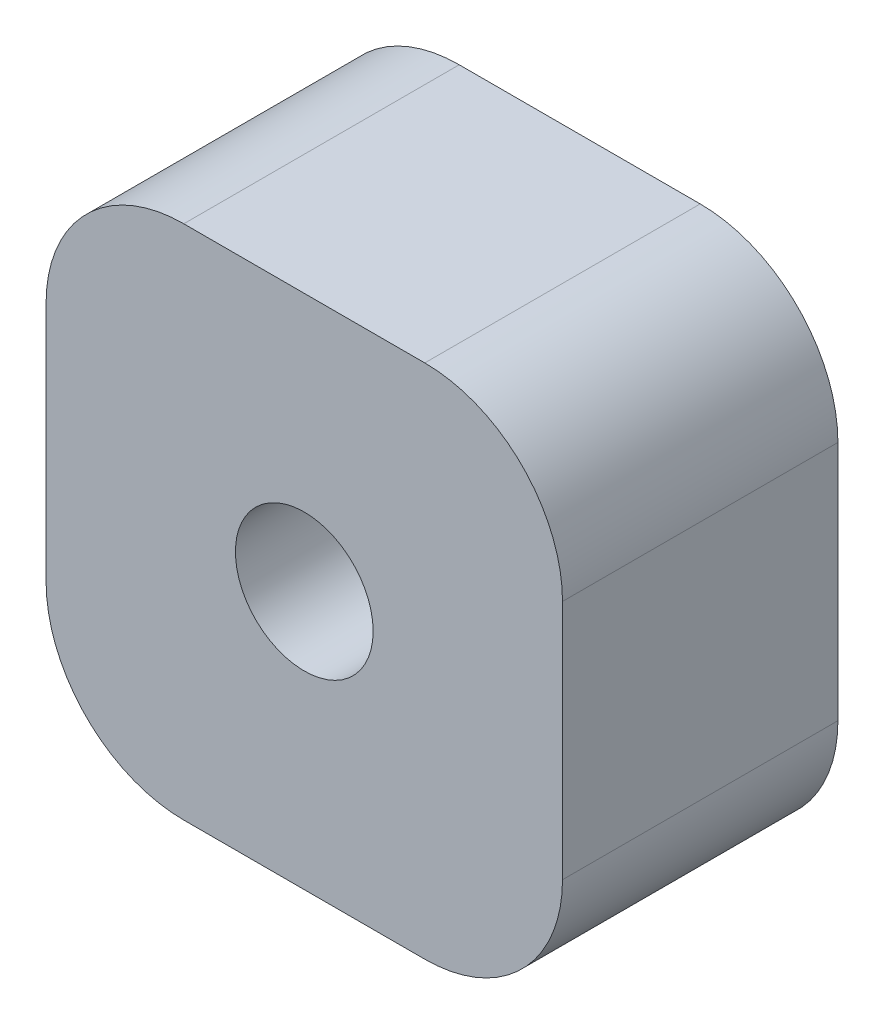
from build123d import *

# Parameters (mm, degrees)
SKETCH_1_W      = 15
SKETCH_1_H      = 15
SKETCH_1_R      = 2
EXTRUDE_1_DEPTH = 8
FILLET_1_R      = 4


with BuildPart() as part:
    # 草图1 → 凸台-拉伸1 (new body)
    with BuildSketch(Plane.XY):
        Rectangle(SKETCH_1_W, SKETCH_1_H)
        Circle(SKETCH_1_R, mode=Mode.SUBTRACT)
    extrude(amount=EXTRUDE_1_DEPTH)

    # 圆角1
    fillet_1_edges = [part.edges().sort_by_distance(p)[0] for p in [
        (7.5, -7.5, 4),
        (-7.5, -7.5, 4),
        (-7.5, 7.5, 4),
        (7.5, 7.5, 4),
    ]]
    fillet(fillet_1_edges, radius=FILLET_1_R)


solid = part.part
